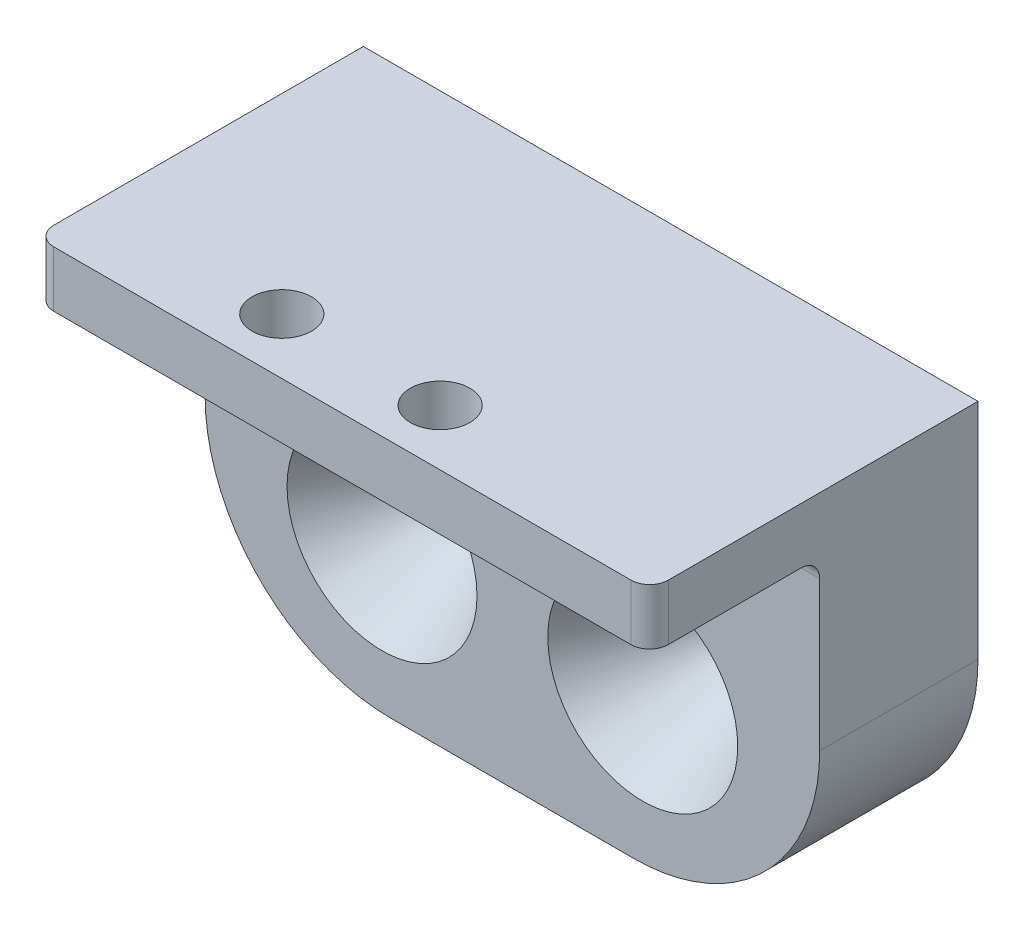
from build123d import *

# Parameters (mm, degrees)
SKETCH_1_W          = 33
SKETCH_1_H          = 16
EXTRUDE_1_DEPTH     = 8.5
SKETCH_4_R          = 1.6
EXTRUDE_2_DEPTH     = 6
FILLET_1_R          = 10
SKETCH_5_W          = 8.5
SKETCH_5_H          = 6
EXTRUDE_3_DEPTH     = 33
CUT_EXTRUDE_1_REACH = 38.991
SKETCH_6_W          = 9.13
SKETCH_6_H          = 3
FILLET_2_R          = 1


with BuildPart() as part:
    # 草图1 → 凸台-拉伸1 (new body)
    with BuildSketch(Plane.XY):
        Rectangle(SKETCH_1_W, SKETCH_1_H)
    extrude(amount=-EXTRUDE_1_DEPTH)

    # 草图3 → 切除-旋转1 (revolve, cut)
    with BuildSketch(Plane(origin=(0, 0, 0), x_dir=(1, 0, 0), z_dir=(0, 1, 0)), mode=Mode.PRIVATE) as cut_revolve_1_sk:
        Polygon((-7, 0), (-7, 6.1), (-8.578163358, 6.1), (-12.1, 0), align=None)
    cut_revolve_1 = revolve(cut_revolve_1_sk.sketch.rotate(Axis((-7, 0, 0), (0, 0, -1)), 180), axis=Axis((-7, 0, 0), (0, 0, -1)), mode=Mode.SUBTRACT)

    # 镜向1: 切除-旋转1 across plane
    add(cut_revolve_1.mirror(Plane(origin=(0, 0, 0), x_dir=(0, 0, 1), z_dir=(1, 0, 0))), mode=Mode.SUBTRACT)

    # 圆角1
    fillet_1_edges = [part.edges().sort_by_distance(p)[0] for p in [
        (16.5, -8, -4.25),
        (-16.5, -8, -4.25),
    ]]
    fillet(fillet_1_edges, radius=FILLET_1_R)



with BuildPart() as body_2:
    # 草图4 → 凸台-拉伸2 (new body)
    with BuildSketch(Plane(origin=(0, 8, 0), x_dir=(1, 0, 0), z_dir=(0, 1, 0))):
        Polygon((-16.5, 0), (-10.5, 0), (6.5, 0), (16.5, 0), (16.5, -9.13), (-16.5, -9.13), align=None)
        with Locations(Location((-6.25, -6.13, 0), (0, 0, 270))):
            Circle(SKETCH_4_R, mode=Mode.SUBTRACT)
        with Locations(Location((2.25, -6.13, 0), (0, 0, 270))):
            Circle(SKETCH_4_R, mode=Mode.SUBTRACT)
    extrude(amount=EXTRUDE_2_DEPTH)


with BuildPart() as part_1:
    add(part.part)

    add(body_2.part)  # 凸台-拉伸3 merges body 2
    # 草图5 → 凸台-拉伸3 (add)
    with BuildSketch(Plane(origin=(16.5, 0, 0), x_dir=(0, 0, -1), z_dir=(1, 0, 0))):
        with Locations((4.25, 11)):
            Rectangle(SKETCH_5_W, SKETCH_5_H)
    extrude(amount=-EXTRUDE_3_DEPTH)

    # 草图6 → 切除-拉伸1 (cut, up to next)
    with BuildSketch(Plane(origin=(16.5, 0, 0), x_dir=(0, 0, -1), z_dir=(1, 0, 0)), mode=Mode.PRIVATE) as cut_extrude_1_sk1:
        with Locations((-4.565, 9.5)):
            Rectangle(SKETCH_6_W, SKETCH_6_H)
    cut_extrude_1_tool1 = extrude(cut_extrude_1_sk1.sketch, amount=-CUT_EXTRUDE_1_REACH, mode=Mode.PRIVATE) & part_1.part
    add(cut_extrude_1_tool1.solids().sort_by_distance((16.5, 9.5, 4.565))[0], mode=Mode.SUBTRACT)

    # 圆角2
    fillet_2_edges = [part_1.edges().sort_by_distance(p)[0] for p in [
        (-16.5, 12.5, 9.13),
        (16.5, 12.5, 9.13),
        (0, 11, 0),
    ]]
    fillet(fillet_2_edges, radius=FILLET_2_R)


solid = part_1.part
